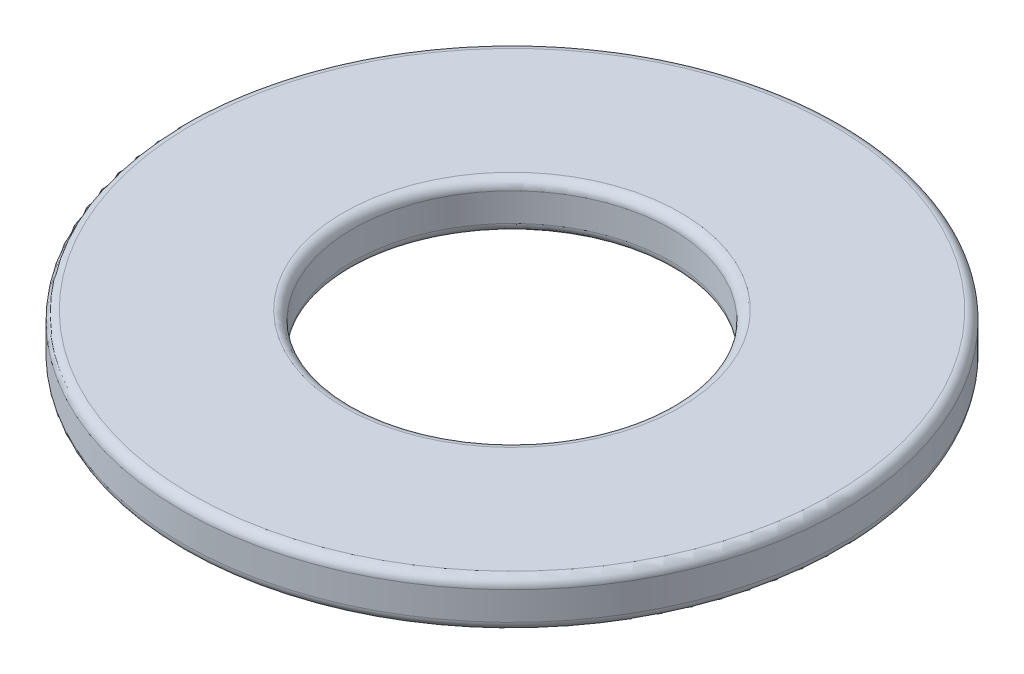
from build123d import *

# Parameters (mm, degrees)
SKETCH_1_R      = 3.5
SKETCH_1_R_2    = 1.69
EXTRUDE_1_DEPTH = 0.5
FILLET_1_R      = 0.1


with BuildPart() as part:
    # 草图1 → 凸台-拉伸1 (new body)
    with BuildSketch(Plane(origin=(0, 0, 0), x_dir=(1, 0, 0), z_dir=(0, 1, 0))):
        with Locations(Location((0, 0, 0), (0, 0, 270))):
            Circle(SKETCH_1_R)
        with Locations(Location((0, 0, 0), (0, 0, 270))):
            Circle(SKETCH_1_R_2, mode=Mode.SUBTRACT)
    extrude(amount=EXTRUDE_1_DEPTH)

    # 圆角1
    fillet_1_edges = [part.edges().sort_by_distance(p)[0] for p in [
        (0, 0, -3.5),
        (0, 0.5, -3.5),
        (0, 0, -1.69),
        (0, 0.5, -1.69),
    ]]
    fillet(fillet_1_edges, radius=FILLET_1_R)


solid = part.part
